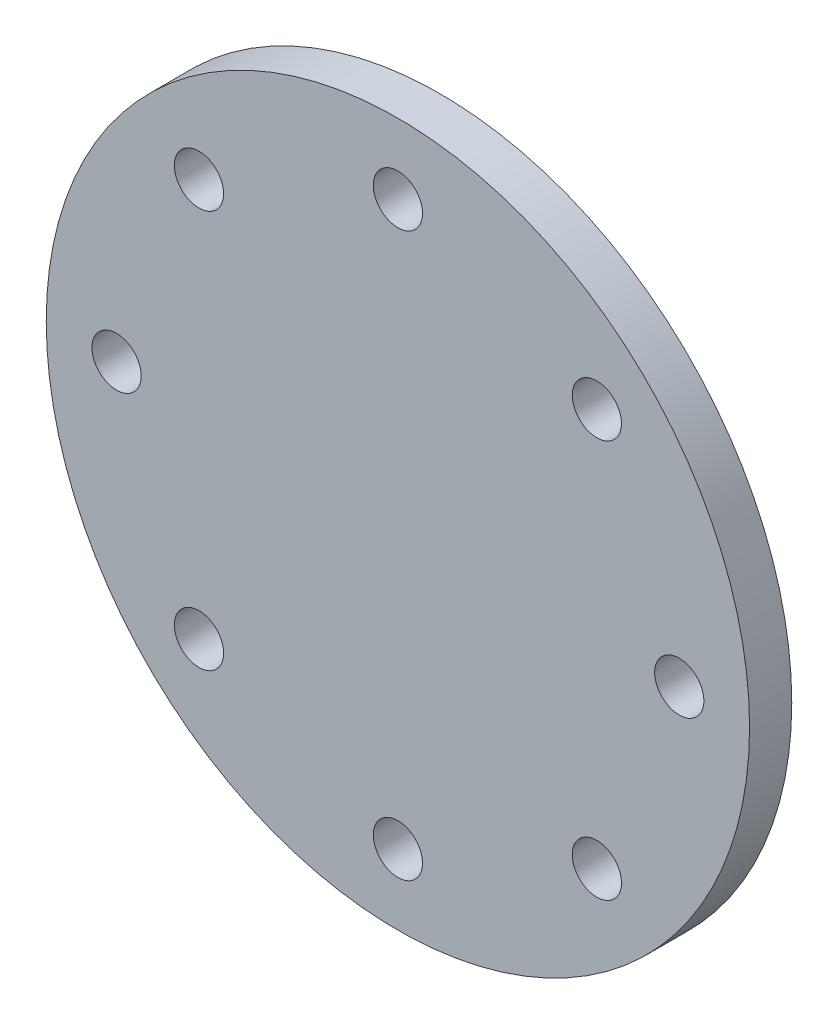
from build123d import *

# Parameters (mm, degrees)
SKETCH1_R           = 25
BOSS_EXTRUDE1_DEPTH = 3
SKETCH2_R           = 1.75
CUT_EXTRUDE1_DEPTH  = 3
CIRPATTERN1_COUNT   = 8


with BuildPart() as part:
    # Sketch1 → Boss-Extrude1 (new body)
    with BuildSketch(Plane.XY):
        Circle(SKETCH1_R)
    extrude(amount=BOSS_EXTRUDE1_DEPTH)

    # Sketch2 → Cut-Extrude1 (cut)
    with BuildSketch(Plane.XY.offset(3)):
        with Locations((0, 20)):
            Circle(SKETCH2_R)
    cut_extrude1 = extrude(amount=-CUT_EXTRUDE1_DEPTH, mode=Mode.SUBTRACT)

    # CirPattern1: Cut-Extrude1 ×8 about axis
    cirpattern1_axis = Axis((0, 0, 0), (0, 0, 1))
    for i in range(1, CIRPATTERN1_COUNT):
        add(cut_extrude1.rotate(cirpattern1_axis, i * 360 / CIRPATTERN1_COUNT), mode=Mode.SUBTRACT)


solid = part.part
